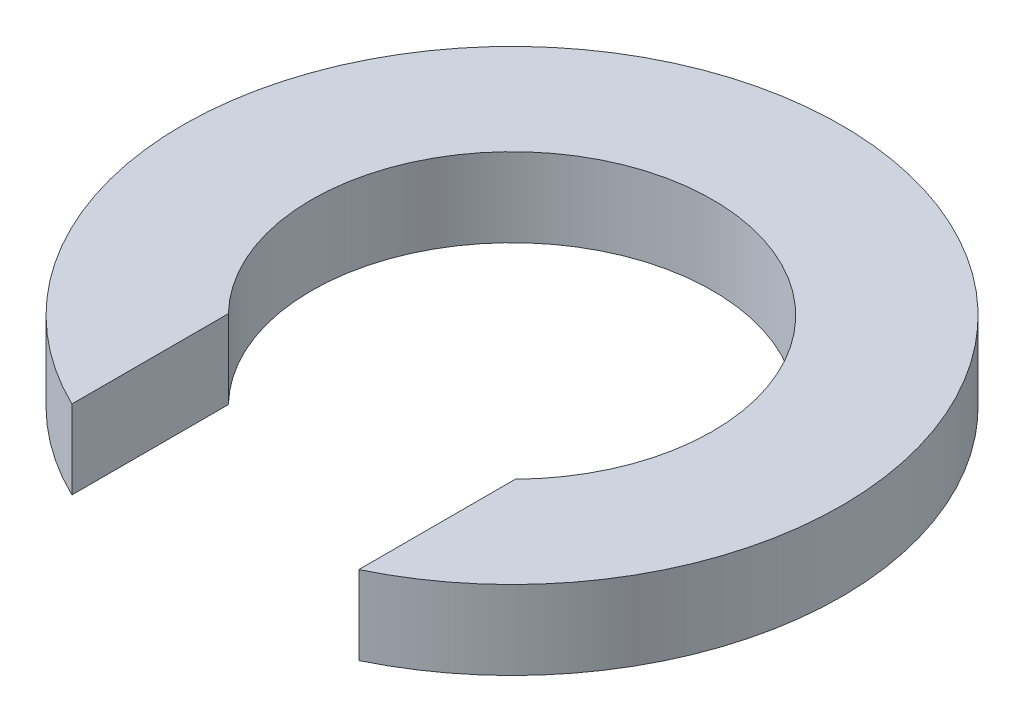
from build123d import *

# Parameters (mm, degrees)
CROQUIS1_R              = 11.5
CROQUIS1_R_2            = 7
SALIENTE_EXTRUIR1_DEPTH = 2.75
CROQUIS2_W              = 10.010478692
CROQUIS2_H              = 6.606373626
CORTAR_EXTRUIR1_DEPTH   = 17.494317203


with BuildPart() as part:
    # Croquis1 → Saliente-Extruir1 (new body)
    with BuildSketch(Plane(origin=(0, 0, 0), x_dir=(1, 0, 0), z_dir=(0, 1, 0))):
        with Locations(Location((0, 0, 0), (0, 0, 270))):
            Circle(CROQUIS1_R)
        with Locations(Location((0, 0, 0), (0, 0, 270))):
            Circle(CROQUIS1_R_2, mode=Mode.SUBTRACT)
    extrude(amount=SALIENTE_EXTRUIR1_DEPTH)

    # Croquis2 → Cortar-Extruir1 (cut, through all)
    with BuildSketch(Plane(origin=(0, 2.75, 0), x_dir=(1, 0, 0), z_dir=(0, 1, 0))):
        with Locations((0, -8.196813187)):
            Rectangle(CROQUIS2_W, CROQUIS2_H)
    extrude(amount=-CORTAR_EXTRUIR1_DEPTH, mode=Mode.SUBTRACT)


solid = part.part
